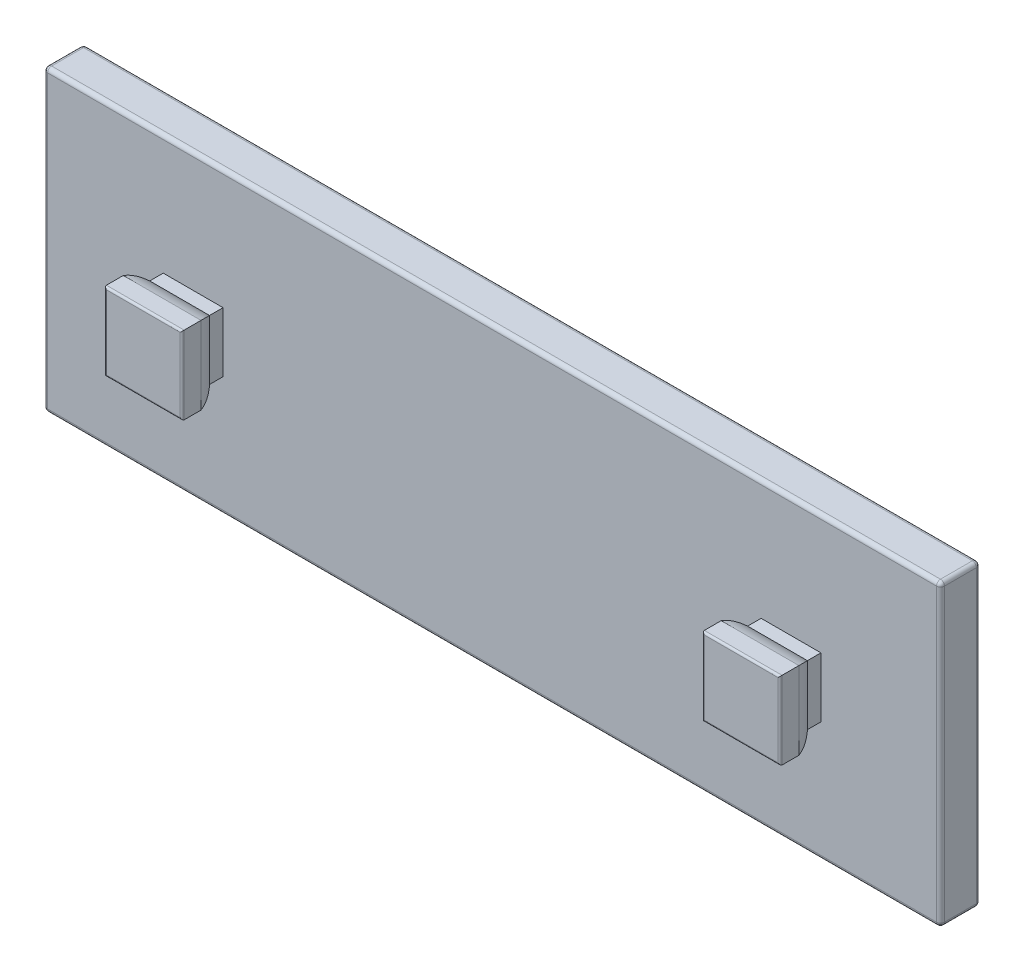
from build123d import *

# Parameters (mm, degrees)
SKETCH_1_W           = 45
SKETCH_1_H           = 15
EXTRUDE_1_DEPTH      = 2
SKETCH_2_W           = 3
SKETCH_2_H           = 3
EXTRUDE_2_DEPTH      = 1
EXTRUDE_3_DEPTH      = 2
EXTRUDE_3_DEPTH_BACK = 2
CUT_EXTRUDE_1_DEPTH  = 41.234344782
FILLET_1_R           = 0.2
FILLET_2_R           = 0.1


with BuildPart() as part:
    # 草图1 → 凸台-拉伸1 (new body)
    with BuildSketch(Plane.XY):
        Rectangle(SKETCH_1_W, SKETCH_1_H)
    extrude(amount=-EXTRUDE_1_DEPTH)

    # 草图2 → 凸台-拉伸2 (add)
    with BuildSketch(Plane.XY):
        with Locations((-15, 0)):
            Rectangle(SKETCH_2_W, SKETCH_2_H)
        with Locations((15, 0)):
            Rectangle(SKETCH_2_W, SKETCH_2_H)
    extrude(amount=EXTRUDE_2_DEPTH)

    # 草图3 → 凸台-拉伸3 (add, two sides: drawn at the far end of the back side and taken through both)
    with BuildSketch(Plane(origin=(0, 0, 0), x_dir=(1, 0, 0), z_dir=(0, 1, 0)).offset(-EXTRUDE_3_DEPTH_BACK)):
        with BuildLine():
            Line((-16.95, -2.5), (-13.05, -2.5))
            Line((-13.05, -2.5), (-13.05, -1.555590279))
            ThreePointArc((-13.05, -1.555590279), (-13.219957697, -1.088161527), (-13.5, -0.677124344))
            Line((-13.5, -0.677124344), (-16.5, -0.677124344))
            ThreePointArc((-16.5, -0.677124344), (-16.780042303, -1.088161527), (-16.95, -1.555590279))
            Line((-16.95, -1.555590279), (-16.95, -2.5))
        make_face()
        with BuildLine():
            Line((16.5, -0.677124344), (13.5, -0.677124344))
            ThreePointArc((13.5, -0.677124344), (13.219957697, -1.088161527), (13.05, -1.555590279))
            Line((13.05, -1.555590279), (13.05, -2.5))
            Line((13.05, -2.5), (16.95, -2.5))
            Line((16.95, -2.5), (16.95, -1.555590279))
            ThreePointArc((16.95, -1.555590279), (16.780042303, -1.088161527), (16.5, -0.677124344))
        make_face()
    extrude(amount=EXTRUDE_3_DEPTH + EXTRUDE_3_DEPTH_BACK)

    # 草图4 → 切除-拉伸1 (cut, through all)
    with BuildSketch(Plane.ZY.offset(16.95)):
        with BuildLine():
            Line((2.5, 1.95), (1.555590279, 1.95))
            ThreePointArc((1.555590279, 1.95), (1.088161527, 1.780042303), (0.677124344, 1.5))
            Line((0.677124344, 1.5), (0.677124344, 2))
            Line((0.677124344, 2), (2.5, 2))
            Line((2.5, 2), (2.5, 1.95))
        make_face()
        with BuildLine():
            Line((0.677124344, -2), (2.5, -2))
            Line((2.5, -2), (2.5, -1.95))
            Line((2.5, -1.95), (1.555590279, -1.95))
            ThreePointArc((1.555590279, -1.95), (1.088161527, -1.780042303), (0.677124344, -1.5))
            Line((0.677124344, -1.5), (0.677124344, -2))
        make_face()
    extrude(amount=-CUT_EXTRUDE_1_DEPTH, mode=Mode.SUBTRACT)

    # 圆角1
    fillet_1_edges = [part.edges().sort_by_distance(p)[0] for p in [
        (22.5, 0, -2),
        (0, 7.5, -2),
        (-22.5, 0, -2),
        (0, 7.5, 0),
        (22.5, 0, 0),
        (0, -7.5, 0),
        (-22.5, 0, 0),
        (0, -7.5, -2),
        (-22.5, 7.5, -1),
        (22.5, 7.5, -1),
        (22.5, -7.5, -1),
        (-22.5, -7.5, -1),
    ]]
    fillet(fillet_1_edges, radius=FILLET_1_R)

    # 圆角2
    fillet_2_edges = [part.edges().sort_by_distance(p)[0] for p in [
        (13.05, 0, 2.5),
        (16.95, 0, 2.5),
        (-16.95, 0, 2.5),
        (-13.05, 0, 2.5),
        (-15, -1.95, 2.5),
        (15, -1.95, 2.5),
        (-15, 1.95, 2.5),
        (15, 1.95, 2.5),
    ]]
    fillet(fillet_2_edges, radius=FILLET_2_R)


solid = part.part
